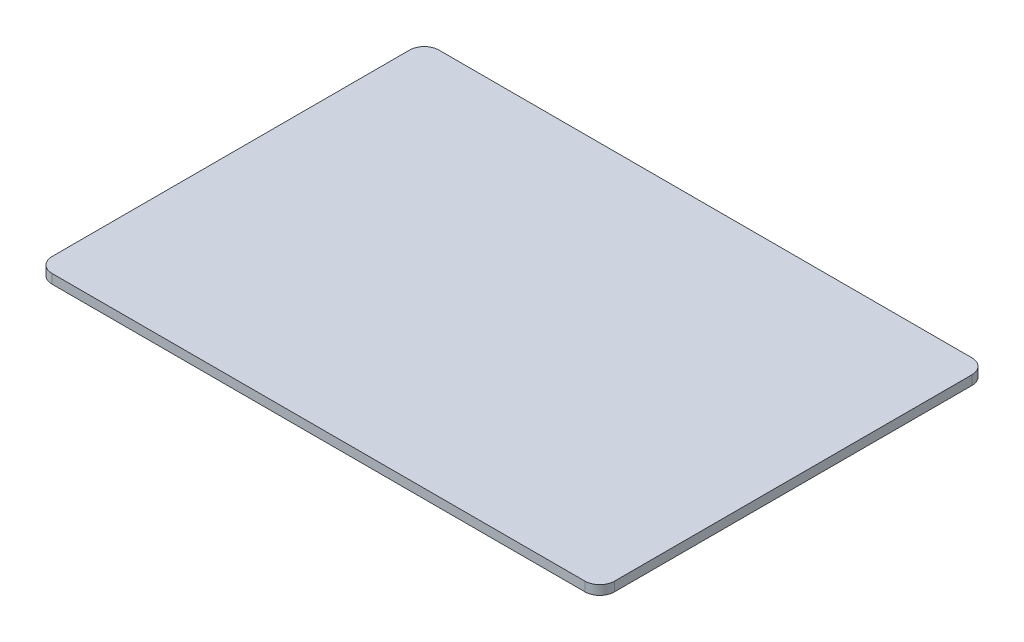
from build123d import *

# Parameters (mm, degrees)
BOSS_EXTRUDE1_DEPTH = 6.35


with BuildPart() as part:
    # Sketch1 → Boss-Extrude1 (new body)
    with BuildSketch(Plane(origin=(0, 0, 0), x_dir=(1, 0, 0), z_dir=(0, 1, 0))):
        with BuildLine():
            Line((-181.65, -131.85), (181.65, -131.85))
            ThreePointArc((181.65, -131.85), (188.721067812, -128.921067812), (191.65, -121.85))
            Line((191.65, -121.85), (191.65, 121.85))
            ThreePointArc((191.65, 121.85), (188.721067812, 128.921067812), (181.65, 131.85))
            Line((181.65, 131.85), (-181.65, 131.85))
            ThreePointArc((-181.65, 131.85), (-188.721067812, 128.921067812), (-191.65, 121.85))
            Line((-191.65, 121.85), (-191.65, -121.85))
            ThreePointArc((-191.65, -121.85), (-188.721067812, -128.921067812), (-181.65, -131.85))
        make_face()
    extrude(amount=BOSS_EXTRUDE1_DEPTH)


solid = part.part
